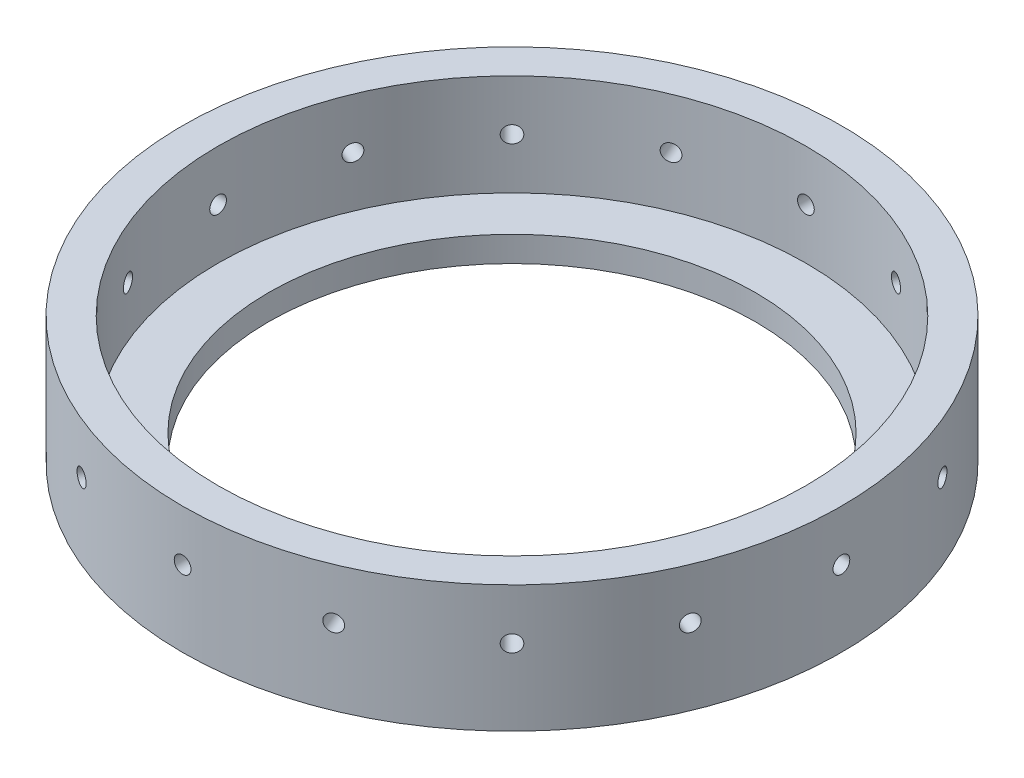
from build123d import *

# Parameters (mm, degrees)
SZYK_KO_OWY1_COUNT = 16


with BuildPart() as part:
    # Szkic2 → Obrót1 (revolve)
    with BuildSketch(Plane.XY, mode=Mode.PRIVATE) as obr_t1_sk:
        Polygon((48, -12.5), (65, -12.5), (65, 12.5), (58, 12.5), (58, -7.5), (48, -7.5), align=None)
    revolve(obr_t1_sk.sketch.rotate(Axis((0, 61.180827225, 0), (0, -1, 0)), 90), axis=Axis((0, 61.180827225, 0), (0, -1, 0)))

    # Szkic3 → Otwór gwintowany M4x0.71 (revolve, cut)
    with BuildSketch(Plane(origin=(65, 2.5, 0), x_dir=(0, 0, -1), z_dir=(0, 1, 0))):
        Polygon((0, 0), (0, 10), (1.65, 9.008579979), (1.65, 0), align=None)
    otw_r_gwintowany_m4x0_71 = revolve(axis=Axis((71.35, 2.5, 0), (-1, 0, 0)), mode=Mode.SUBTRACT)

    # Szyk kołowy1: Otwór gwintowany M4x0.71 ×16 about axis
    szyk_ko_owy1_axis = Axis((0, 61.180827225, 0), (0, 1, 0))
    for i in range(1, SZYK_KO_OWY1_COUNT):
        add(otw_r_gwintowany_m4x0_71.rotate(szyk_ko_owy1_axis, i * 360 / SZYK_KO_OWY1_COUNT), mode=Mode.SUBTRACT)


solid = part.part
